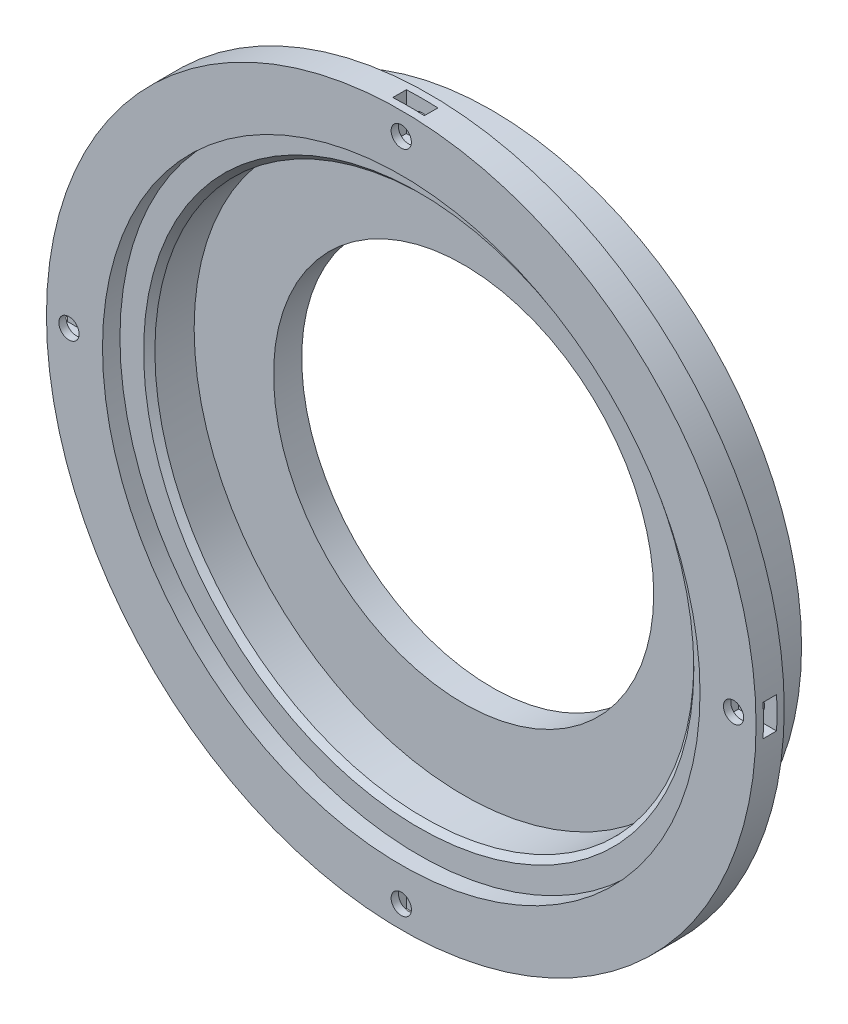
from build123d import *

# Parameters (mm, degrees)
SKETCH2_R               = 1.8
CUT_EXTRUDE1_DEPTH      = 10
SKETCH3_W               = 5.6
SKETCH3_H               = 10.691433847
CUT_EXTRUDE2_DEPTH      = 2.4
BOSS_EXTRUDE1_DEPTH     = 2.5
SKETCH5_R               = 1.8
CUT_EXTRUDE3_DEPTH      = 92.554113097
SKETCH6_W               = 5.6
SKETCH6_H               = 10.168713577
SKETCH6_W_2             = 10.168713577
SKETCH6_H_2             = 5.6
CUT_EXTRUDE4_DEPTH      = 2.4
CUT_EXTRUDE5_DEPTH      = 95.516678422
CUT_EXTRUDE5_DEPTH_BACK = 95.516678422
SKETCH7_W               = 158.937204397
SKETCH7_H               = 29.823360181
SKETCH8_R               = 53.05
CUT_EXTRUDE6_DEPTH      = 3.1
CHAMFER1_SIZE           = 1
CHAMFER3_SIZE           = 0.5
CHAMFER4_SIZE           = 0.5
CHAMFER5_SIZE           = 1


with BuildPart() as part:
    # Sketch1 → Revolve1 (revolve)
    with BuildSketch(Plane(origin=(0, 0, 0), x_dir=(1, 0, 0), z_dir=(0, 1, 0))):
        Polygon((43.05, 0), (43.05, 5.5), (40.025, 5.5), (40.025, 8.05), (33.75, 8.05), (33.75, 11.55), (47.85, 11.55), (47.85, 26.55), (33.75, 26.55), (33.75, 31.55), (46.9, 31.55), (46.9, 29.55), (50.35, 29.55), (50.35, 24.55), (53.5, 24.55), (53.5, 31.55), (55, 31.55), (55, 20.475), (63, 20.475), (63, 10.475), (55, 10.475), (55, 0), align=None)
    revolve(axis=Axis((0, 0, 39.851832449), (0, 0, -1)))

    # Sketch2 → Cut-Extrude1 (cut)
    with BuildSketch(Plane.XY):
        with Locations((0, 50)):
            Circle(SKETCH2_R)
        with Locations((43.301270189, 25)):
            Circle(SKETCH2_R)
        with Locations((43.301270189, -25)):
            Circle(SKETCH2_R)
        with Locations((0, -50)):
            Circle(SKETCH2_R)
        with Locations((-43.301270189, -25)):
            Circle(SKETCH2_R)
        with Locations((-43.301270189, 25)):
            Circle(SKETCH2_R)
    extrude(amount=-CUT_EXTRUDE1_DEPTH, mode=Mode.SUBTRACT)

    # Sketch3 → Cut-Extrude2 (cut)
    with BuildSketch(Plane.XY.offset(-5)):
        with Locations((0, 52.545716924)):
            Rectangle(SKETCH3_W, SKETCH3_H)
        Polygon((51.535452373, 26.520845793), (48.735452373, 31.370588054), (39.476399059, 26.024871131), (42.276399059, 21.175128869), align=None)
        Polygon((48.735452373, -31.370588054), (51.535452373, -26.520845793), (42.276399059, -21.175128869), (39.476399059, -26.024871131), align=None)
        with Locations((0, -52.545716924)):
            Rectangle(SKETCH3_W, SKETCH3_H)
        Polygon((-51.535452373, -26.520845793), (-48.735452373, -31.370588054), (-39.476399059, -26.024871131), (-42.276399059, -21.175128869), align=None)
        Polygon((-48.735452373, 31.370588054), (-51.535452373, 26.520845793), (-42.276399059, 21.175128869), (-39.476399059, 26.024871131), align=None)
    extrude(amount=-CUT_EXTRUDE2_DEPTH, mode=Mode.SUBTRACT)

    # Sketch4 → Boss-Extrude1 (add)
    with BuildSketch(Plane.XY.offset(-5.5)):
        with BuildLine():
            Line((-2.45, 42.980228012), (-2.45, 39.949945244))
            ThreePointArc((-2.45, 39.949945244), (0, 40.025), (2.45, 39.949945244))
            Line((2.45, 39.949945244), (2.45, 42.980228012))
            ThreePointArc((2.45, 42.980228012), (0, 43.05), (-2.45, 42.980228012))
        make_face()
    extrude(amount=BOSS_EXTRUDE1_DEPTH)

    # Sketch5 → Cut-Extrude3 (cut, through all)
    with BuildSketch(Plane.XY.offset(-10.475)):
        with Locations((0, 59)):
            Circle(SKETCH5_R)
        with Locations((59, 0)):
            Circle(SKETCH5_R)
        with Locations((0, -59)):
            Circle(SKETCH5_R)
        with Locations((-59, 0)):
            Circle(SKETCH5_R)
    extrude(amount=-CUT_EXTRUDE3_DEPTH, mode=Mode.SUBTRACT)

    # Sketch6 → Cut-Extrude4 (cut)
    with BuildSketch(Plane.XY.offset(-16.775)):
        with Locations((0, 61.284356789)):
            Rectangle(SKETCH6_W, SKETCH6_H)
        with Locations((61.284356789, 0)):
            Rectangle(SKETCH6_W_2, SKETCH6_H_2)
        with Locations((0, -61.284356789)):
            Rectangle(SKETCH6_W, SKETCH6_H)
        with Locations((-61.284356789, 0)):
            Rectangle(SKETCH6_W_2, SKETCH6_H_2)
    extrude(amount=-CUT_EXTRUDE4_DEPTH, mode=Mode.SUBTRACT)

    # Sketch7 → Cut-Extrude5 (cut, two sides: drawn at the far end of the back side and taken through both)
    with BuildSketch(Plane(origin=(0, 0, 0), x_dir=(1, 0, 0), z_dir=(0, 1, 0)).offset(-CUT_EXTRUDE5_DEPTH_BACK)):
        with Locations((-3.919975894, 0.56331991)):
            Rectangle(SKETCH7_W, SKETCH7_H)
    extrude(amount=CUT_EXTRUDE5_DEPTH + CUT_EXTRUDE5_DEPTH_BACK, mode=Mode.SUBTRACT)

    # Sketch8 → Cut-Extrude6 (cut)
    with BuildSketch(Plane.XY.offset(-15.475)):
        Circle(SKETCH8_R)
    extrude(amount=-CUT_EXTRUDE6_DEPTH, mode=Mode.SUBTRACT)

    # Chamfer1
    chamfer1_edges = [part.edges().sort_by_distance(p)[0] for p in [
        (-55, 0, -20.475),
    ]]
    chamfer(chamfer1_edges, length=CHAMFER1_SIZE)

    # Chamfer3
    chamfer3_edges = [part.edges().sort_by_distance(p)[0] for p in [
        (-50.35, 0, -29.55),
    ]]
    chamfer(chamfer3_edges, length=CHAMFER3_SIZE)

    # Chamfer4
    chamfer4_edges = [part.edges().sort_by_distance(p)[0] for p in [
        (-53.5, 0, -31.55),
    ]]
    chamfer(chamfer4_edges, length=CHAMFER4_SIZE)

    # Chamfer5
    chamfer5_edges = [part.edges().sort_by_distance(p)[0] for p in [
        (-47.85, 0, -18.575),
    ]]
    chamfer(chamfer5_edges, length=CHAMFER5_SIZE)


solid = part.part
